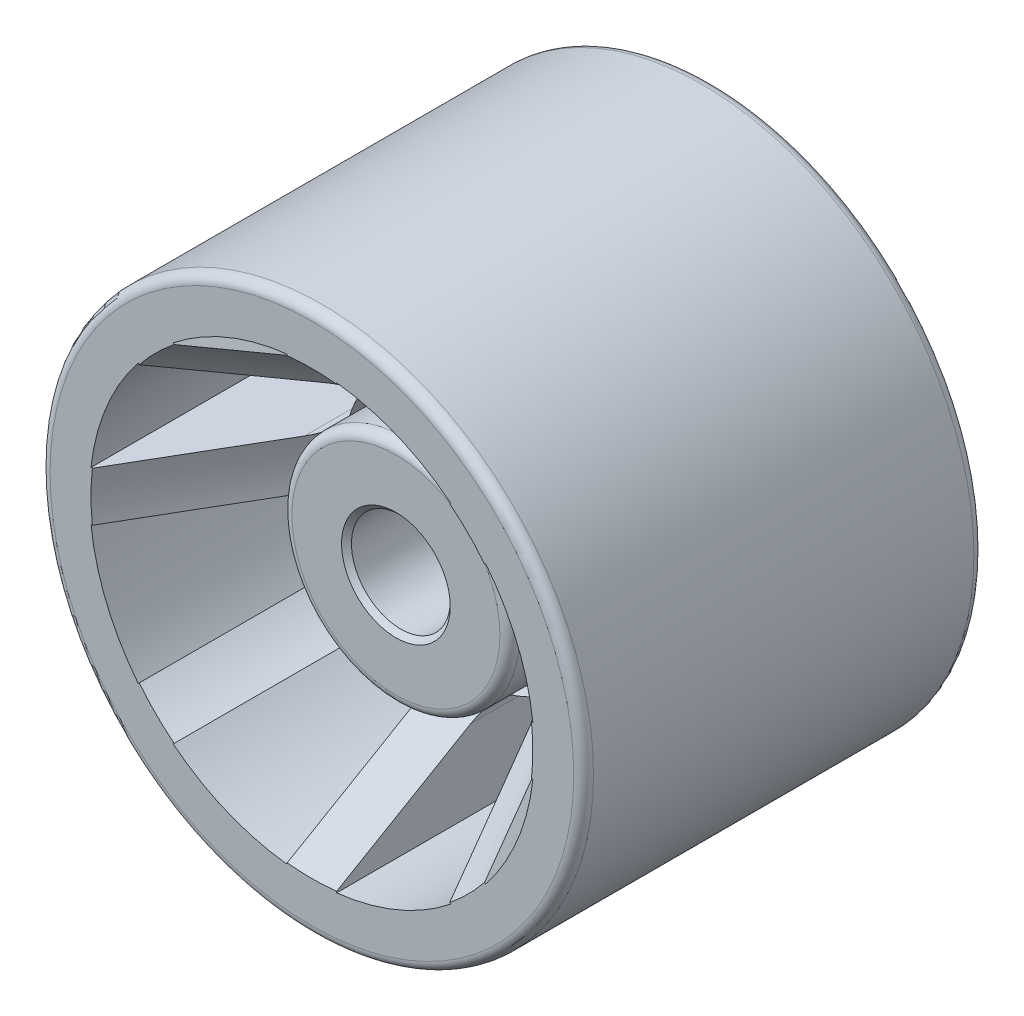
from build123d import *

# Parameters (mm, degrees)
SKIZZE1_R                       = 27.5
AUFSATZ_LINEAR_AUSTRAGEN1_DEPTH = 40.5
SKIZZE2_R                       = 5
SCHNITT_LINEAR_AUSTRAGEN1_DEPTH = 57.149354404
VERRUNDUNG1_R                   = 2
SKIZZE4_R                       = 11.526695863
SCHNITT_LINEAR_AUSTRAGEN2_DEPTH = 8.5
SKIZZE5_R                       = 11.526695863
SCHNITT_LINEAR_AUSTRAGEN3_DEPTH = 8.5
VERRUNDUNG5_R                   = 1
VERRUNDUNG8_R                   = 1
FASE1_SIZE                      = 0.5


with BuildPart() as part:
    # Skizze1 → Aufsatz-Linear austragen1 (new body)
    with BuildSketch(Plane.XY):
        Circle(SKIZZE1_R)
    extrude(amount=AUFSATZ_LINEAR_AUSTRAGEN1_DEPTH)

    # Skizze2 → Schnitt-Linear austragen1 (cut, through all)
    with BuildSketch(Plane.XY.offset(40.5)):
        Circle(SKIZZE2_R)
        with BuildLine():
            Line((-14.043621348, 17.579155254), (-7.253042323, 10.788576229))
            ThreePointArc((-7.253042323, 10.788576229), (-4.974884621, 12.010433923), (-2.5, 12.757350822))
            Line((-2.5, 12.757350822), (-2.5, 22.360679775))
            ThreePointArc((-2.5, 22.360679775), (-8.610377228, 20.787289482), (-14.043621348, 17.579155254))
        make_face()
        with BuildLine():
            Line((14.043621348, 17.579155254), (7.253042323, 10.788576229))
            ThreePointArc((7.253042323, 10.788576229), (4.974884621, 12.010433923), (2.5, 12.757350822))
            Line((2.5, 12.757350822), (2.5, 22.360679775))
            ThreePointArc((2.5, 22.360679775), (8.610377228, 20.787289482), (14.043621348, 17.579155254))
        make_face()
        with BuildLine():
            Line((22.360679775, 2.5), (12.757350822, 2.5))
            ThreePointArc((12.757350822, 2.5), (12.010433923, 4.974884621), (10.788576229, 7.253042323))
            Line((10.788576229, 7.253042323), (17.579155254, 14.043621348))
            ThreePointArc((17.579155254, 14.043621348), (20.787289482, 8.610377228), (22.360679775, 2.5))
        make_face()
        with BuildLine():
            Line((17.579155254, -14.043621348), (10.788576229, -7.253042323))
            ThreePointArc((10.788576229, -7.253042323), (12.010433923, -4.974884621), (12.757350822, -2.5))
            Line((12.757350822, -2.5), (22.360679775, -2.5))
            ThreePointArc((22.360679775, -2.5), (20.787289482, -8.610377228), (17.579155254, -14.043621348))
        make_face()
        with BuildLine():
            Line((2.5, -22.360679775), (2.5, -12.757350822))
            ThreePointArc((2.5, -12.757350822), (4.974884621, -12.010433923), (7.253042323, -10.788576229))
            Line((7.253042323, -10.788576229), (14.043621348, -17.579155254))
            ThreePointArc((14.043621348, -17.579155254), (8.610377228, -20.787289482), (2.5, -22.360679775))
        make_face()
        with BuildLine():
            Line((-14.043621348, -17.579155254), (-7.253042323, -10.788576229))
            ThreePointArc((-7.253042323, -10.788576229), (-4.974884621, -12.010433923), (-2.5, -12.757350822))
            Line((-2.5, -12.757350822), (-2.5, -22.360679775))
            ThreePointArc((-2.5, -22.360679775), (-8.610377228, -20.787289482), (-14.043621348, -17.579155254))
        make_face()
        with BuildLine():
            Line((-22.360679775, -2.5), (-12.757350822, -2.5))
            ThreePointArc((-12.757350822, -2.5), (-12.010433923, -4.974884621), (-10.788576229, -7.253042323))
            Line((-10.788576229, -7.253042323), (-17.579155254, -14.043621348))
            ThreePointArc((-17.579155254, -14.043621348), (-20.787289482, -8.610377228), (-22.360679775, -2.5))
        make_face()
        with BuildLine():
            Line((-17.579155254, 14.043621348), (-10.788576229, 7.253042323))
            ThreePointArc((-10.788576229, 7.253042323), (-12.010433923, 4.974884621), (-12.757350822, 2.5))
            Line((-12.757350822, 2.5), (-22.360679775, 2.5))
            ThreePointArc((-22.360679775, 2.5), (-20.787289482, 8.610377228), (-17.579155254, 14.043621348))
        make_face()
    extrude(amount=-SCHNITT_LINEAR_AUSTRAGEN1_DEPTH, mode=Mode.SUBTRACT)

    # Verrundung1
    verrundung1_edges = [part.edges().sort_by_distance(p)[0] for p in [
        (10.788576229, -7.253042323, 20.25),
        (12.757350822, -2.5, 20.25),
        (12.757350822, 2.5, 20.25),
        (10.788576229, 7.253042323, 20.25),
        (7.253042323, 10.788576229, 20.25),
        (2.5, 12.757350822, 20.25),
        (-2.5, 12.757350822, 20.25),
        (-7.253042323, 10.788576229, 20.25),
        (-10.788576229, 7.253042323, 20.25),
        (-12.757350822, 2.5, 20.25),
        (-12.757350822, -2.5, 20.25),
        (-10.788576229, -7.253042323, 20.25),
        (-7.253042323, -10.788576229, 20.25),
        (-2.5, -12.757350822, 20.25),
        (2.5, -12.757350822, 20.25),
        (7.253042323, -10.788576229, 20.25),
    ]]
    fillet(verrundung1_edges, radius=VERRUNDUNG1_R)

    # Skizze3 → Schnitt-Rotation1 (revolve, cut)
    with BuildSketch(Plane(origin=(0, 0, 0), x_dir=(1, 0, 0), z_dir=(0, 1, 0)), mode=Mode.PRIVATE) as schnitt_rotation1_sk:
        Polygon((22.360679775, -40.5), (11.526695863, -21.734989416), (11.526695863, -40.5), align=None)
        Polygon((11.526695863, 0), (22.360679775, 0), (11.526695863, -18.765010584), align=None)
    revolve(schnitt_rotation1_sk.sketch.rotate(Axis((0, 0, 0), (0, 0, 1)), 180), axis=Axis((0, 0, 0), (0, 0, 1)), mode=Mode.SUBTRACT)

    # Skizze4 → Schnitt-Linear austragen2 (cut)
    with BuildSketch(Plane.XY.offset(40.5)):
        with Locations(Location((0, 0, 0), (0, 0, 180))):
            Circle(SKIZZE4_R)
    extrude(amount=-SCHNITT_LINEAR_AUSTRAGEN2_DEPTH, mode=Mode.SUBTRACT)

    # Skizze5 → Schnitt-Linear austragen3 (cut)
    with BuildSketch(Plane(origin=(0, 0, 0), x_dir=(-1, 0, 0), z_dir=(0, 0, -1))):
        Circle(SKIZZE5_R)
    extrude(amount=-SCHNITT_LINEAR_AUSTRAGEN3_DEPTH, mode=Mode.SUBTRACT)

    # Verrundung5
    verrundung5_edges = [part.edges().sort_by_distance(p)[0] for p in [
        (-27.5, 0, 0),
        (-27.5, 0, 40.5),
    ]]
    fillet(verrundung5_edges, radius=VERRUNDUNG5_R)

    # Verrundung8
    verrundung8_edges = [part.edges().sort_by_distance(p)[0] for p in [
        (11.526695863, 0, 32),
        (11.526695863, 0, 8.5),
    ]]
    fillet(verrundung8_edges, radius=VERRUNDUNG8_R)

    # Fase1
    fase1_edges = [part.edges().sort_by_distance(p)[0] for p in [
        (-5, 0, 32),
        (-5, 0, 8.5),
    ]]
    chamfer(fase1_edges, length=FASE1_SIZE)


solid = part.part
